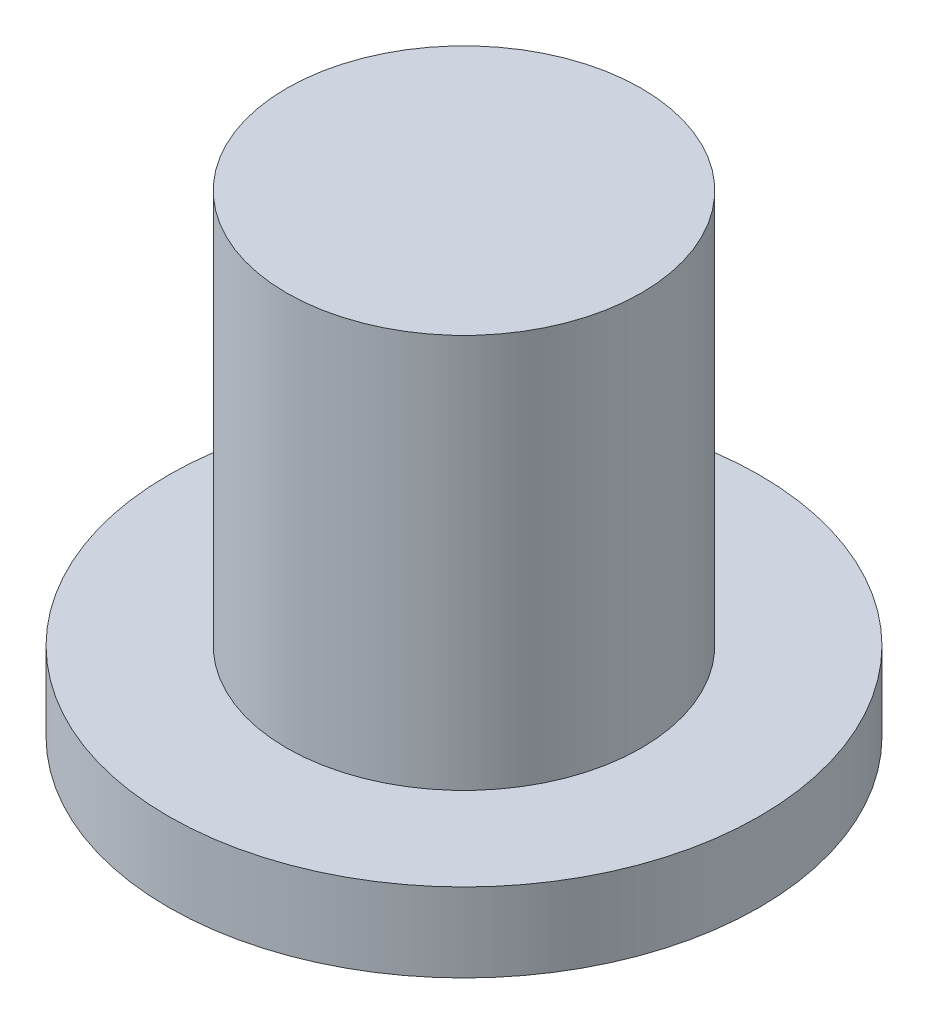
from build123d import *

# Parameters (mm, degrees)
SKETCH1_R           = 1.905
BOSS_EXTRUDE1_DEPTH = 0.508
SKETCH2_R           = 1.143
BOSS_EXTRUDE2_DEPTH = 2.54


with BuildPart() as part:
    # Sketch1 → Boss-Extrude1 (new body)
    with BuildSketch(Plane(origin=(0, 0, 0), x_dir=(1, 0, 0), z_dir=(0, 1, 0))):
        with Locations(Location((0, 0, 0), (0, 0, 270))):
            Circle(SKETCH1_R)
    extrude(amount=BOSS_EXTRUDE1_DEPTH)

    # Sketch2 → Boss-Extrude2 (add)
    with BuildSketch(Plane(origin=(0, 0.508, 0), x_dir=(1, 0, 0), z_dir=(0, 1, 0))):
        with Locations(Location((0, 0, 0), (0, 0, 270))):
            Circle(SKETCH2_R)
    extrude(amount=BOSS_EXTRUDE2_DEPTH)


solid = part.part
